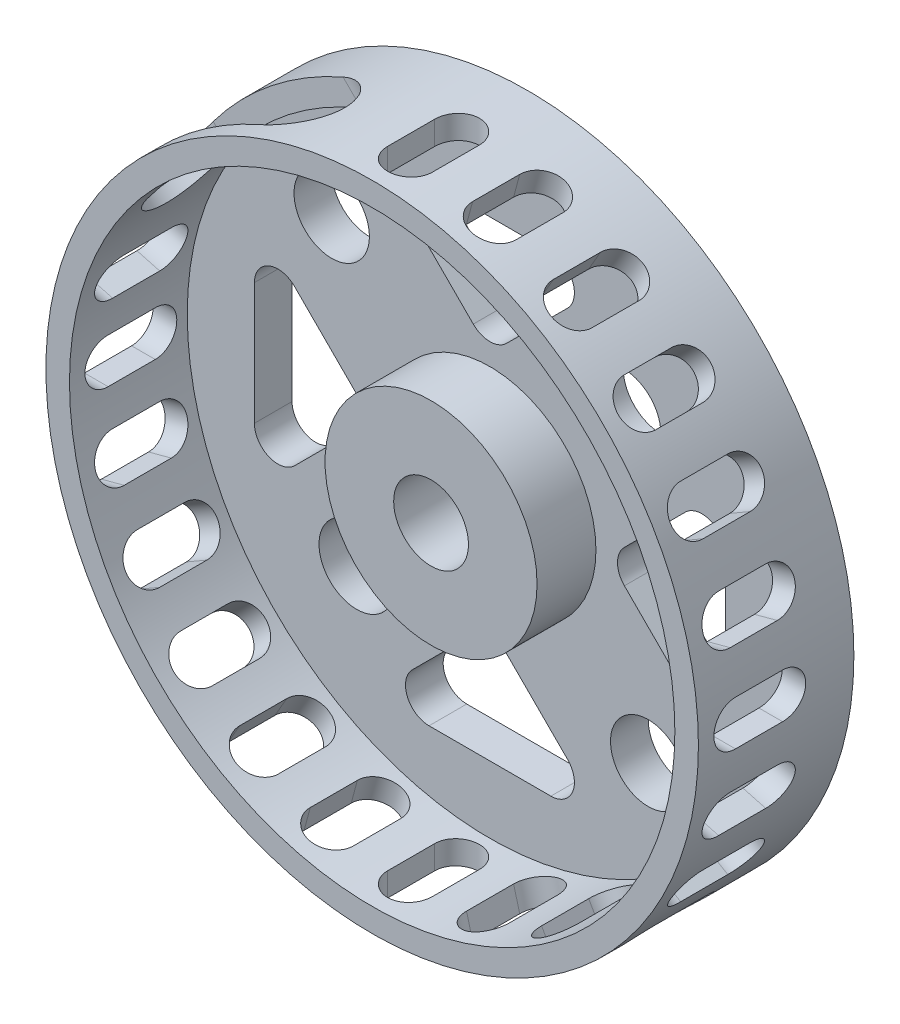
from build123d import *

# Parameters (mm, degrees)
SKETCH1_R                = 13.85
BOSS_EXTRUDE1_DEPTH      = 6.6
SKETCH3_R                = 12.85
CUT_EXTRUDE1_DEPTH       = 5
SKETCH4_R                = 4.5
SKETCH4_R_2              = 1.6
CUT_EXTRUDE2_DEPTH       = 4.6
BOSS_EXTRUDE3_DEPTH      = 2.5
BOSS_EXTRUDE3_DEPTH_BACK = 1.5
SKETCH5_R                = 4.5
SKETCH6_R                = 2.65
BOSS_EXTRUDE4_DEPTH      = 0.5
SKETCH7_R                = 1.5875
CUT_EXTRUDE3_DEPTH       = 21.800120192
CUT_EXTRUDE4_DEPTH       = 29.358508423
CIRPATTERN1_COUNT        = 20
CIRPATTERN1_ANGLE        = 285
CUT_EXTRUDE5_DEPTH       = 5.1


with BuildPart() as part:
    # Sketch1 → Boss-Extrude1 (new body)
    with BuildSketch(Plane.XY):
        Circle(SKETCH1_R)
    extrude(amount=BOSS_EXTRUDE1_DEPTH)

    # Sketch3 → Cut-Extrude1 (cut)
    with BuildSketch(Plane.XY.offset(6.6)):
        Circle(SKETCH3_R)
    extrude(amount=-CUT_EXTRUDE1_DEPTH, mode=Mode.SUBTRACT)

    # Sketch4 → Cut-Extrude2 (cut)
    with BuildSketch(Plane.XY.offset(1.6)):
        Circle(SKETCH4_R)
        with Locations((-6.717514421, 6.717514421)):
            Circle(SKETCH4_R_2)
        with Locations((5.656854249, 5.656854249)):
            Circle(SKETCH4_R_2)
        with Locations((-5.656854249, -5.656854249)):
            Circle(SKETCH4_R_2)
        with Locations((6.717514421, -6.717514421)):
            Circle(SKETCH4_R_2)
        with BuildLine():
            Line((0, 10), (2.585786438, 10))
            ThreePointArc((2.585786438, 10), (3.50966597, 9.382683432), (3.292893219, 8.292893219))
            Line((3.292893219, 8.292893219), (0.707106781, 5.707106781))
            ThreePointArc((0.707106781, 5.707106781), (0, 5.414213562), (-0.707106781, 5.707106781))
            Line((-0.707106781, 5.707106781), (-3.292893219, 8.292893219))
            ThreePointArc((-3.292893219, 8.292893219), (-3.50966597, 9.382683432), (-2.585786438, 10))
            Line((-2.585786438, 10), (0, 10))
        make_face()
        with BuildLine():
            Line((5.707106781, -0.707106781), (8.292893219, -3.292893219))
            ThreePointArc((8.292893219, -3.292893219), (9.382683432, -3.50966597), (10, -2.585786438))
            Line((10, -2.585786438), (10, 0))
            Line((10, 0), (10, 2.585786438))
            ThreePointArc((10, 2.585786438), (9.382683432, 3.50966597), (8.292893219, 3.292893219))
            Line((8.292893219, 3.292893219), (5.707106781, 0.707106781))
            ThreePointArc((5.707106781, 0.707106781), (5.414213562, 0), (5.707106781, -0.707106781))
        make_face()
        with BuildLine():
            Line((-0.707106781, -5.707106781), (-3.292893219, -8.292893219))
            ThreePointArc((-3.292893219, -8.292893219), (-3.50966597, -9.382683432), (-2.585786438, -10))
            Line((-2.585786438, -10), (0, -10))
            Line((0, -10), (2.585786438, -10))
            ThreePointArc((2.585786438, -10), (3.50966597, -9.382683432), (3.292893219, -8.292893219))
            Line((3.292893219, -8.292893219), (0.707106781, -5.707106781))
            ThreePointArc((0.707106781, -5.707106781), (0, -5.414213562), (-0.707106781, -5.707106781))
        make_face()
        with BuildLine():
            Line((-5.707106781, 0.707106781), (-8.292893219, 3.292893219))
            ThreePointArc((-8.292893219, 3.292893219), (-9.382683432, 3.50966597), (-10, 2.585786438))
            Line((-10, 2.585786438), (-10, 0))
            Line((-10, 0), (-10, -2.585786438))
            ThreePointArc((-10, -2.585786438), (-9.382683432, -3.50966597), (-8.292893219, -3.292893219))
            Line((-8.292893219, -3.292893219), (-5.707106781, -0.707106781))
            ThreePointArc((-5.707106781, -0.707106781), (-5.414213562, 0), (-5.707106781, 0.707106781))
        make_face()
    extrude(amount=-CUT_EXTRUDE2_DEPTH, mode=Mode.SUBTRACT)

    # Sketch5 → Boss-Extrude3 (add, two sides: drawn at the far end of the back side and taken through both)
    with BuildSketch(Plane.XY.offset(1.6).offset(-BOSS_EXTRUDE3_DEPTH_BACK)):
        Circle(SKETCH5_R)
    extrude(amount=BOSS_EXTRUDE3_DEPTH + BOSS_EXTRUDE3_DEPTH_BACK)

    # Sketch6 → Boss-Extrude4 (add)
    with BuildSketch(Plane(origin=(0, 0, 0.1), x_dir=(-1, 0, 0), z_dir=(0, 0, -1))):
        with Locations(Location((0, 0, 0), (0, 0, 180))):
            Circle(SKETCH6_R)
    extrude(amount=BOSS_EXTRUDE4_DEPTH)

    # Sketch7 → Cut-Extrude3 (cut, through all)
    with BuildSketch(Plane(origin=(0, 0, -0.4), x_dir=(-1, 0, 0), z_dir=(0, 0, -1))):
        Circle(SKETCH7_R)
    extrude(amount=-CUT_EXTRUDE3_DEPTH, mode=Mode.SUBTRACT)

    # Sketch10 → Cut-Extrude4 (cut, through all)
    with BuildSketch(Plane(origin=(0, 10, 0), x_dir=(1, 0, 0), z_dir=(0, 1, 0))):
        with BuildLine():
            Line((0.95, -2.994336291), (0.95, -4.994336291))
            ThreePointArc((0.95, -4.994336291), (0, -5.944336291), (-0.95, -4.994336291))
            Line((-0.95, -4.994336291), (-0.95, -2.994336291))
            ThreePointArc((-0.95, -2.994336291), (0, -2.044336291), (0.95, -2.994336291))
        make_face()
    cut_extrude4 = extrude(amount=CUT_EXTRUDE4_DEPTH, mode=Mode.SUBTRACT)

    # CirPattern1: Cut-Extrude4 ×20 about axis
    cirpattern1_axis = Axis((0, 0, 0), (0, 0, -1))
    for i in range(1, CIRPATTERN1_COUNT):
        add(cut_extrude4.rotate(cirpattern1_axis, i * CIRPATTERN1_ANGLE / (CIRPATTERN1_COUNT - 1)), mode=Mode.SUBTRACT)

    # Sketch11 → Cut-Extrude5 (cut)
    with BuildSketch(Plane(origin=(-9.793428919, 9.793428919, 0), x_dir=(0, 0, -1), z_dir=(-0.7071067811865488, 0.7071067811865464, 0))):
        with BuildLine():
            Line((-5.744336291, -5.006322931), (-5.744336291, 1.993677069))
            ThreePointArc((-5.744336291, 1.993677069), (-3.994336291, 3.743677069), (-2.244336291, 1.993677069))
            Line((-2.244336291, 1.993677069), (-2.244336291, -5.006322931))
            ThreePointArc((-2.244336291, -5.006322931), (-3.994336291, -6.756322931), (-5.744336291, -5.006322931))
        make_face()
    extrude(amount=-CUT_EXTRUDE5_DEPTH, mode=Mode.SUBTRACT)


solid = part.part
